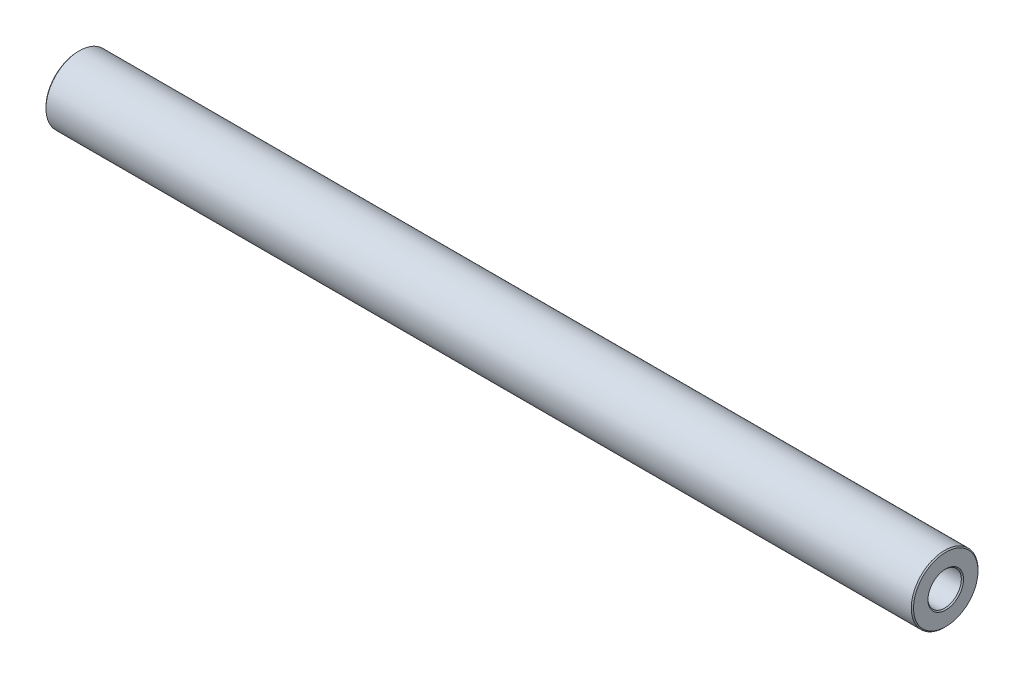
from build123d import *

# Parameters (mm, degrees)
SKETCH1_R           = 3
BOSS_EXTRUDE1_DEPTH = 39
SKETCH2_R           = 1.5
CUT_EXTRUDE1_DEPTH  = 7
CUT_EXTRUDE2_START  = -7
SKETCH3_R           = 1.5
CUT_EXTRUDE2_DEPTH  = 7
CHAMFER1_SIZE       = 0.1


with BuildPart() as part:
    # Sketch1 → Boss-Extrude1 (new, symmetric)
    with BuildSketch(Plane(origin=(0, 0, 0), x_dir=(0, 0, -1), z_dir=(1, 0, 0))):
        Circle(SKETCH1_R)
    extrude(amount=BOSS_EXTRUDE1_DEPTH, both=True)

    # Sketch2 → Cut-Extrude1 (cut)
    with BuildSketch(Plane.ZY.offset(39)):
        Circle(SKETCH2_R)
    extrude(amount=-CUT_EXTRUDE1_DEPTH, mode=Mode.SUBTRACT)

    # Sketch3 → Cut-Extrude2 (cut)
    with BuildSketch(Plane(origin=(39, 0, 0), x_dir=(0, 0, -1), z_dir=(1, 0, 0)).offset(CUT_EXTRUDE2_START)):
        with Locations(Location((0, 0, 0), (0, 0, 180))):
            Circle(SKETCH3_R)
    extrude(amount=CUT_EXTRUDE2_DEPTH, mode=Mode.SUBTRACT)

    # Chamfer1
    chamfer1_edges = [part.edges().sort_by_distance(p)[0] for p in [
        (39, 0, -1.5),
        (-39, 0, 3),
        (39, 0, 3),
        (-39, 0, -1.5),
    ]]
    chamfer(chamfer1_edges, length=CHAMFER1_SIZE)


solid = part.part
